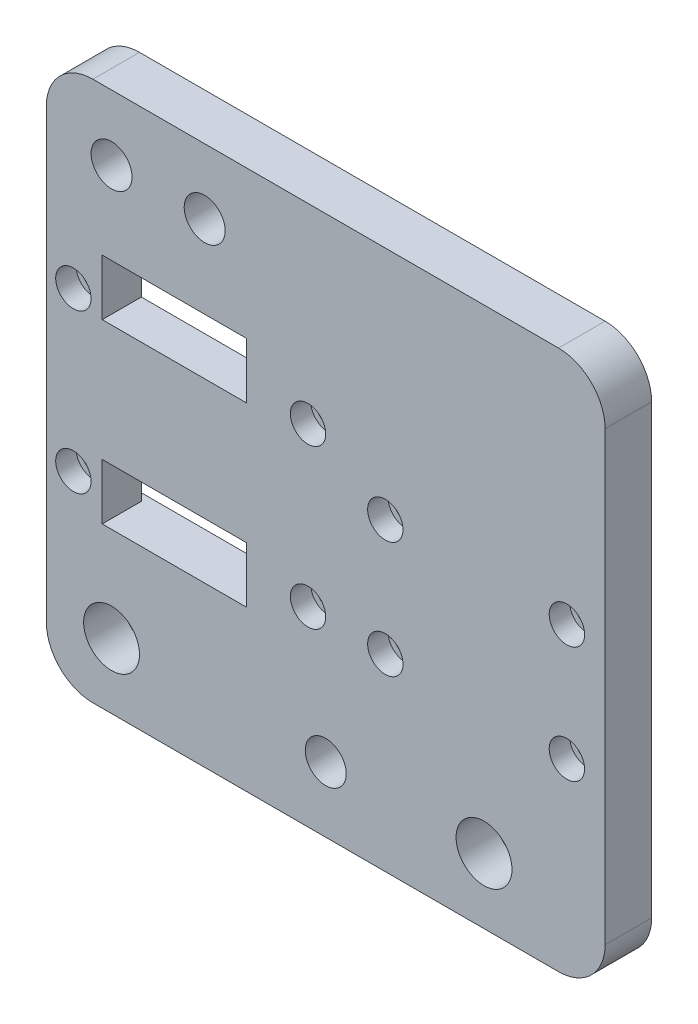
from build123d import *

# Parameters (mm, degrees)
SKETCH_1_W           = 54
SKETCH_1_H           = 58
SKETCH_1_R           = 3
EXTRUDE_1_DEPTH      = 5
SKETCH_3_R           = 6
CUT_EXTRUDE_1_DEPTH  = 0.8
CUT_EXTRUDE_2_REACH  = 81.404
SKETCH_4_R           = 1.25
SKETCH_5_W           = 31.5
SKETCH_5_H           = 25
CUT_EXTRUDE_3_DEPTH  = 0.8
CUT_EXTRUDE_4_REACH  = 81.358
SKETCH_6_W           = 15.5
SKETCH_6_H           = 6
CUT_EXTRUDE_START    = -2.2
SKETCH_7_R           = 1.9
SKETCH_7_R_2         = 1.25
CUT_EXTRUDE_5_DEPTH  = 2.2
SKETCH_8_W           = 5
SKETCH_8_H           = 58
EXTRUDE_2_DEPTH      = 6
SKETCH_9_W           = 27.5
SKETCH_9_H           = 33.5
CUT_EXTRUDE_6_DEPTH  = 0.8
SKETCH_10_R          = 1.25
CUT_EXTRUDE_7_DEPTH  = 4.2
SKETCH_11_R          = 1.9
CUT_EXTRUDE_8_DEPTH  = 2.2
FILLET_1_R           = 5
SKETCH_12_W          = 60
SKETCH_12_H          = 3
EXTRUDE_3_DEPTH      = 20
EXTRUDE_3_2_DEPTH    = 20
SKETCH_13_W          = 60
SKETCH_13_H          = 3
EXTRUDE_4_DEPTH      = 3
SKETCH_14_R          = 2.2
CUT_EXTRUDE_9_DEPTH  = 5
EXTRUDE_START        = -5
SKETCH_15_R          = 2.2
EXTRUDE_5_DEPTH      = 5
CUT_EXTRUDE_10_REACH = 81.107
SKETCH_16_W          = 27.5
SKETCH_16_H          = 10
SKETCH_17_W          = 7
SKETCH_17_H          = 27
EXTRUDE_6_DEPTH      = 3
SKETCH_18_W          = 27.5
SKETCH_18_H          = 3
SKETCH_18_W_2        = 15.5
SKETCH_18_H_2        = 6
EXTRUDE_8_DEPTH      = 3
CUT_EXTRUDE_11_DEPTH = 3
SKETCH_20_W          = 10
SKETCH_20_H          = 4.5
SKETCH_20_W_2        = 10.2
SKETCH_20_H_2        = 4.4
CUT_EXTRUDE_12_DEPTH = 3
SKETCH_21_W          = 17
SKETCH_21_H          = 4
EXTRUDE_9_DEPTH      = 20
FILLET_2_R           = 5


with BuildPart() as part:
    # 草图1 → 凸台-拉伸1 (new body)
    with BuildSketch(Plane.XY):
        with Locations((27, 29)):
            Rectangle(SKETCH_1_W, SKETCH_1_H)
        with Locations((7, 7)):
            Circle(SKETCH_1_R, mode=Mode.SUBTRACT)
        with Locations((47, 7)):
            Circle(SKETCH_1_R, mode=Mode.SUBTRACT)
    extrude(amount=EXTRUDE_1_DEPTH)

    # 草图3 → 切除-拉伸1 (cut)
    with BuildSketch(Plane(origin=(0, 0, 0), x_dir=(-1, 0, 0), z_dir=(0, 0, -1))):
        with Locations((-47, 7)):
            Circle(SKETCH_3_R)
        with Locations((-7, 7)):
            Circle(SKETCH_3_R)
    extrude(amount=-CUT_EXTRUDE_1_DEPTH, mode=Mode.SUBTRACT)

    # 草图4 → 切除-拉伸2 (cut, up to next)
    with BuildSketch(Plane(origin=(0, 0, 0), x_dir=(-1, 0, 0), z_dir=(0, 0, -1)), mode=Mode.PRIVATE) as cut_extrude_2_sk1:
        with Locations((-28.1, 37.5)):
            Circle(SKETCH_4_R)
    cut_extrude_2_tool1 = extrude(cut_extrude_2_sk1.sketch, amount=-CUT_EXTRUDE_2_REACH, mode=Mode.PRIVATE) & part.part
    # 草图4 → 切除-拉伸2 (cut, up to next)
    with BuildSketch(Plane(origin=(0, 0, 0), x_dir=(-1, 0, 0), z_dir=(0, 0, -1)), mode=Mode.PRIVATE) as cut_extrude_2_sk2:
        with Locations((-2.9, 37.5)):
            Circle(SKETCH_4_R)
    cut_extrude_2_tool2 = extrude(cut_extrude_2_sk2.sketch, amount=-CUT_EXTRUDE_2_REACH, mode=Mode.PRIVATE) & part.part
    # 草图4 → 切除-拉伸2 (cut, up to next)
    with BuildSketch(Plane(origin=(0, 0, 0), x_dir=(-1, 0, 0), z_dir=(0, 0, -1)), mode=Mode.PRIVATE) as cut_extrude_2_sk3:
        with Locations((-28.1, 20.5)):
            Circle(SKETCH_4_R)
    cut_extrude_2_tool3 = extrude(cut_extrude_2_sk3.sketch, amount=-CUT_EXTRUDE_2_REACH, mode=Mode.PRIVATE) & part.part
    # 草图4 → 切除-拉伸2 (cut, up to next)
    with BuildSketch(Plane(origin=(0, 0, 0), x_dir=(-1, 0, 0), z_dir=(0, 0, -1)), mode=Mode.PRIVATE) as cut_extrude_2_sk4:
        with Locations((-2.9, 20.5)):
            Circle(SKETCH_4_R)
    cut_extrude_2_tool4 = extrude(cut_extrude_2_sk4.sketch, amount=-CUT_EXTRUDE_2_REACH, mode=Mode.PRIVATE) & part.part
    add(cut_extrude_2_tool1.solids().sort_by_distance((28.1, 37.5, 0))[0], mode=Mode.SUBTRACT)
    add(cut_extrude_2_tool2.solids().sort_by_distance((2.9, 37.5, 0))[0], mode=Mode.SUBTRACT)
    add(cut_extrude_2_tool3.solids().sort_by_distance((28.1, 20.5, 0))[0], mode=Mode.SUBTRACT)
    add(cut_extrude_2_tool4.solids().sort_by_distance((2.9, 20.5, 0))[0], mode=Mode.SUBTRACT)

    # 草图5 → 切除-拉伸3 (cut)
    with BuildSketch(Plane(origin=(0, 0, 0), x_dir=(-1, 0, 0), z_dir=(0, 0, -1))):
        with Locations((-15.75, 29.640349145)):
            Rectangle(SKETCH_5_W, SKETCH_5_H)
    extrude(amount=-CUT_EXTRUDE_3_DEPTH, mode=Mode.SUBTRACT)

    # 草图6 → 切除-拉伸4 (cut, up to next)
    with BuildSketch(Plane(origin=(0, 0, 0.8), x_dir=(-1, 0, 0), z_dir=(0, 0, -1)), mode=Mode.PRIVATE) as cut_extrude_4_sk1:
        with Locations((-13.75, 39.140349145)):
            Rectangle(SKETCH_6_W, SKETCH_6_H)
    cut_extrude_4_tool1 = extrude(cut_extrude_4_sk1.sketch, amount=-CUT_EXTRUDE_4_REACH, mode=Mode.PRIVATE) & part.part
    # 草图6 → 切除-拉伸4 (cut, up to next)
    with BuildSketch(Plane(origin=(0, 0, 0.8), x_dir=(-1, 0, 0), z_dir=(0, 0, -1)), mode=Mode.PRIVATE) as cut_extrude_4_sk2:
        with Locations((-13.75, 20.140349145)):
            Rectangle(SKETCH_6_W, SKETCH_6_H)
    cut_extrude_4_tool2 = extrude(cut_extrude_4_sk2.sketch, amount=-CUT_EXTRUDE_4_REACH, mode=Mode.PRIVATE) & part.part
    add(cut_extrude_4_tool1.solids().sort_by_distance((13.75, 39.140349, 0.8))[0], mode=Mode.SUBTRACT)
    add(cut_extrude_4_tool2.solids().sort_by_distance((13.75, 20.140349, 0.8))[0], mode=Mode.SUBTRACT)

    # 草图7 → 切除-拉伸5 (cut)
    # profile 1 of 4: a face of its own
    with BuildSketch(Plane.XY.offset(5).offset(CUT_EXTRUDE_START)):
        with Locations((2.9, 37.5)):
            Circle(SKETCH_7_R)
        with Locations(Location((2.9, 37.5, 0), (0, 0, 180))):
            Circle(SKETCH_7_R_2, mode=Mode.SUBTRACT)
    # profile 2 of 4: a face of its own
    with BuildSketch(Plane.XY.offset(5).offset(CUT_EXTRUDE_START)):
        with Locations((28.1, 37.5)):
            Circle(SKETCH_7_R)
        with Locations(Location((28.1, 37.5, 0), (0, 0, 180))):
            Circle(SKETCH_7_R_2, mode=Mode.SUBTRACT)
    # profile 3 of 4: a face of its own
    with BuildSketch(Plane.XY.offset(5).offset(CUT_EXTRUDE_START)):
        with Locations((28.1, 20.5)):
            Circle(SKETCH_7_R)
        with Locations(Location((28.1, 20.5, 0), (0, 0, 180))):
            Circle(SKETCH_7_R_2, mode=Mode.SUBTRACT)
    # profile 4 of 4: a face of its own
    with BuildSketch(Plane.XY.offset(5).offset(CUT_EXTRUDE_START)):
        with Locations((2.9, 20.5)):
            Circle(SKETCH_7_R)
        with Locations(Location((2.9, 20.5, 0), (0, 0, 180))):
            Circle(SKETCH_7_R_2, mode=Mode.SUBTRACT)
    extrude(amount=CUT_EXTRUDE_5_DEPTH, mode=Mode.SUBTRACT)

    # 草图8 → 凸台-拉伸2 (add)
    with BuildSketch(Plane(origin=(54, 0, 0), x_dir=(0, 0, -1), z_dir=(1, 0, 0))):
        with Locations((-2.5, 29)):
            Rectangle(SKETCH_8_W, SKETCH_8_H)
    extrude(amount=EXTRUDE_2_DEPTH)

    # 草图9 → 切除-拉伸6 (cut)
    with BuildSketch(Plane(origin=(0, 0, 0), x_dir=(-1, 0, 0), z_dir=(0, 0, -1))):
        with Locations((-45.25, 33.890349145)):
            Rectangle(SKETCH_9_W, SKETCH_9_H)
    extrude(amount=-CUT_EXTRUDE_6_DEPTH, mode=Mode.SUBTRACT)

    # 草图10 → 切除-拉伸7 (cut)
    with BuildSketch(Plane(origin=(0, 0, 0.8), x_dir=(-1, 0, 0), z_dir=(0, 0, -1))):
        with Locations((-55.9, 32.740349145)):
            Circle(SKETCH_10_R)
        with Locations((-55.9, 20.240349145)):
            Circle(SKETCH_10_R)
        with Locations((-36.4, 20.240349145)):
            Circle(SKETCH_10_R)
        with Locations((-36.4, 32.740349145)):
            Circle(SKETCH_10_R)
    extrude(amount=-CUT_EXTRUDE_7_DEPTH, mode=Mode.SUBTRACT)

    # 草图11 → 切除-拉伸8 (cut)
    with BuildSketch(Plane.XY.offset(5)):
        with Locations((36.4, 20.240349145)):
            Circle(SKETCH_11_R)
        with Locations((55.9, 20.240349145)):
            Circle(SKETCH_11_R)
        with Locations((55.9, 32.740349145)):
            Circle(SKETCH_11_R)
        with Locations((36.4, 32.740349145)):
            Circle(SKETCH_11_R)
    extrude(amount=-CUT_EXTRUDE_8_DEPTH, mode=Mode.SUBTRACT)

    # 圆角1
    fillet_1_edges = [part.edges().sort_by_distance(p)[0] for p in [
        (60, 0, 2.5),
        (60, 58, 2.5),
        (0, 58, 2.5),
        (0, 0, 2.5),
    ]]
    fillet(fillet_1_edges, radius=FILLET_1_R)

    # 草图14 → 切除-拉伸9 (cut)
    with BuildSketch(Plane(origin=(0, 0, 0), x_dir=(-1, 0, 0), z_dir=(0, 0, -1))):
        with Locations((-30, 7)):
            Circle(SKETCH_14_R)
        with Locations((-17, 51)):
            Circle(SKETCH_14_R)
        with Locations((-7, 51)):
            Circle(SKETCH_14_R)
    extrude(amount=-CUT_EXTRUDE_9_DEPTH, mode=Mode.SUBTRACT)


with BuildPart() as body_2:
    # 草图12 → 凸台-拉伸3 (new body)
    with BuildSketch(Plane(origin=(0, 0, 0), x_dir=(-1, 0, 0), z_dir=(0, 0, -1))):
        with Locations((-30, 14.640349145)):
            Rectangle(SKETCH_12_W, SKETCH_12_H)
    extrude(amount=EXTRUDE_3_DEPTH)



with BuildPart() as body_3:
    # 草图12 → Extrude 3 2 (new body)
    with BuildSketch(Plane(origin=(0, 0, 0), x_dir=(-1, 0, 0), z_dir=(0, 0, -1))):
        with BuildLine():
            Line((-60, 53), (-60, 51.640349145))
            Line((-60, 51.640349145), (-30.5, 51.640349145))
            Line((-30.5, 51.640349145), (-30.5, 43.140349145))
            Line((-30.5, 43.140349145), (0, 43.140349145))
            Line((0, 43.140349145), (0, 46.140349145))
            Line((0, 46.140349145), (-27.5, 46.140349145))
            Line((-27.5, 46.140349145), (-27.5, 54.640349145))
            Line((-27.5, 54.640349145), (-59.723267374, 54.640349145))
            ThreePointArc((-59.723267374, 54.640349145), (-59.930331473, 53.831764129), (-60, 53))
        make_face()
    extrude(amount=EXTRUDE_3_2_DEPTH)


with BuildPart() as body_2_1:
    add(body_2.part)

    add(body_3.part)  # 凸台-拉伸4 merges body 3
    # 草图13 → 凸台-拉伸4 (add)
    with BuildSketch(Plane(origin=(0, 0, -20), x_dir=(-1, 0, 0), z_dir=(0, 0, -1))):
        Polygon((0, 43.140349145), (0, 16.140349145), (-60, 16.140349145), (-60, 51.640349145), (-30.5, 51.640349145), (-30.5, 43.140349145), align=None)
        with BuildLine():
            Line((0, 43.140349145), (0, 46.140349145))
            Line((0, 46.140349145), (-27.5, 46.140349145))
            Line((-27.5, 46.140349145), (-27.5, 54.640349145))
            Line((-27.5, 54.640349145), (-59.723267374, 54.640349145))
            ThreePointArc((-59.723267374, 54.640349145), (-59.930331473, 53.831764129), (-60, 53))
            Line((-60, 53), (-60, 51.640349145))
            Line((-60, 51.640349145), (-30.5, 51.640349145))
            Line((-30.5, 51.640349145), (-30.5, 43.140349145))
            Line((-30.5, 43.140349145), (0, 43.140349145))
        make_face()
        with Locations((-30, 14.640349145)):
            Rectangle(SKETCH_13_W, SKETCH_13_H)
    extrude(amount=EXTRUDE_4_DEPTH)

    # 草图15 → 凸台-拉伸5 (add)
    # profile 1 of 3: a face of its own
    with BuildSketch(Plane.XY.offset(EXTRUDE_START)):
        with BuildLine():
            ThreePointArc((34.5, 7), (30, 11.5), (25.5, 7))
            ThreePointArc((25.5, 7), (26.818019485, 3.818019485), (30, 2.5))
            ThreePointArc((30, 2.5), (33.181980515, 3.818019485), (34.5, 7))
        make_face()
        with Locations(Location((30, 7, 0), (0, 0, 180))):
            Circle(SKETCH_15_R, mode=Mode.SUBTRACT)
    # profile 2 of 3: a face of its own
    with BuildSketch(Plane.XY.offset(EXTRUDE_START)):
        with BuildLine():
            Line((25.5, 13.140349145), (25.5, 7))
            ThreePointArc((25.5, 7), (30, 11.5), (34.5, 7))
            Line((34.5, 7), (34.5, 13.140349145))
            Line((34.5, 13.140349145), (25.5, 13.140349145))
        make_face()
    # profile 3 of 3: a face of its own
    with BuildSketch(Plane.XY.offset(EXTRUDE_START)):
        with BuildLine():
            Line((17, 55.140349145), (7, 55.140349145))
            ThreePointArc((7, 55.140349145), (3.818019485, 53.82232966), (2.5, 50.640349145))
            Line((2.5, 50.640349145), (2.5, 46.140349145))
            Line((2.5, 46.140349145), (21.5, 46.140349145))
            Line((21.5, 46.140349145), (21.5, 50.640349145))
            ThreePointArc((21.5, 50.640349145), (20.181980515, 53.82232966), (17, 55.140349145))
        make_face()
        with Locations(Location((7, 51, 0), (0, 0, 180))):
            Circle(SKETCH_15_R, mode=Mode.SUBTRACT)
        with Locations(Location((17, 51, 0), (0, 0, 180))):
            Circle(SKETCH_15_R, mode=Mode.SUBTRACT)
    extrude(amount=EXTRUDE_5_DEPTH)

    # 切除-拉伸10: up to this face of the body (flat: up to its plane)
    cut_extrude_10_end = Plane(body_2_1.part.faces().sort_by_distance((30, 13.140349145, -11.803370787))[0])
    # 草图16 → 切除-拉伸10 (cut, up to the picked face)
    with BuildSketch(Plane(origin=(0, 46.140349145, 0), x_dir=(1, 0, 0), z_dir=(0, 1, 0)), mode=Mode.PRIVATE) as cut_extrude_10_sk1:
        with Locations((13.75, 18)):
            Rectangle(SKETCH_16_W, SKETCH_16_H)
    cut_extrude_10_tool1 = split(extrude(cut_extrude_10_sk1.sketch, amount=-CUT_EXTRUDE_10_REACH, mode=Mode.PRIVATE), bisect_by=cut_extrude_10_end, keep=Keep.BOTH, mode=Mode.PRIVATE)
    add(cut_extrude_10_tool1.solids().sort_by(Axis((13.75, 46.140349, -18), (0, -1, 0)))[0], mode=Mode.SUBTRACT)

    # 草图17 → 凸台-拉伸6 (add)
    with BuildSketch(Plane.ZY.offset(-27.5)):
        with Locations((-16.5, 29.640349145)):
            Rectangle(SKETCH_17_W, SKETCH_17_H)
    extrude(amount=-EXTRUDE_6_DEPTH)

    # 草图18 → 凸台-拉伸8 (add)
    # profile 1 of 2: a face of its own
    with BuildSketch(Plane(origin=(0, 0, -13), x_dir=(-1, 0, 0), z_dir=(0, 0, -1))):
        with Locations((-13.75, 14.640349145)):
            Rectangle(SKETCH_18_W, SKETCH_18_H)
    # profile 2 of 2: a face of its own
    with BuildSketch(Plane(origin=(0, 0, -13), x_dir=(-1, 0, 0), z_dir=(0, 0, -1))):
        Polygon((0, 16.140349145), (0, 17.140349145), (0, 42.140349145), (0, 43.140349145), (0, 46.140349145), (-27.5, 46.140349145), (-27.5, 43.140349145), (-27.5, 16.140349145), align=None)
        with Locations((-13.75, 20.140349145)):
            Rectangle(SKETCH_18_W_2, SKETCH_18_H_2, mode=Mode.SUBTRACT)
        with Locations((-13.75, 39.140349145)):
            Rectangle(SKETCH_18_W_2, SKETCH_18_H_2, mode=Mode.SUBTRACT)
    extrude(amount=EXTRUDE_8_DEPTH)

    # 草图19 → 切除-拉伸11 (cut)
    # profile 1 of 3: a face of its own
    with BuildSketch(Plane(origin=(0, 54.640349145, 0), x_dir=(1, 0, 0), z_dir=(0, 1, 0))):
        Polygon((34, 4.2), (43, 4.2), (43, 11.7), (43, 16.7), (34, 16.7), (34, 11.7), align=None)
    # profile 2 of 3: a face of its own
    with BuildSketch(Plane(origin=(0, 54.640349145, 0), x_dir=(1, 0, 0), z_dir=(0, 1, 0))):
        with BuildLine():
            Line((49.05, 1.7), (54.85, 1.7))
            ThreePointArc((54.85, 1.7), (58.9, 5.75), (54.85, 9.8))
            Line((54.85, 9.8), (49.05, 9.8))
            ThreePointArc((49.05, 9.8), (45, 5.75), (49.05, 1.7))
        make_face()
        with BuildLine():
            ThreePointArc((49.05, 7.3), (47.5, 5.75), (49.05, 4.2))
            Line((49.05, 4.2), (54.85, 4.2))
            ThreePointArc((54.85, 4.2), (56.4, 5.75), (54.85, 7.3))
            Line((54.85, 7.3), (49.05, 7.3))
        make_face(mode=Mode.SUBTRACT)
    # profile 3 of 3: a face of its own
    with BuildSketch(Plane(origin=(0, 54.640349145, 0), x_dir=(1, 0, 0), z_dir=(0, 1, 0))):
        with BuildLine():
            Line((54.85, 7.3), (49.05, 7.3))
            ThreePointArc((49.05, 7.3), (47.5, 5.75), (49.05, 4.2))
            Line((49.05, 4.2), (54.85, 4.2))
            ThreePointArc((54.85, 4.2), (56.4, 5.75), (54.85, 7.3))
        make_face()
    extrude(amount=-CUT_EXTRUDE_11_DEPTH, mode=Mode.SUBTRACT)

    # 草图20 → 切除-拉伸12 (cut)
    with BuildSketch(Plane(origin=(0, 0, -23), x_dir=(-1, 0, 0), z_dir=(0, 0, -1))):
        with Locations((-45.5, 19.390349145)):
            Rectangle(SKETCH_20_W, SKETCH_20_H)
        Polygon((-50.5, 26.140349145), (-50.5, 22.640349145), (-40.5, 22.640349145), (-40.5, 27.140349145), (-49.5, 27.140349145), align=None)
        with Locations((-54.9, 40.340349145)):
            Rectangle(SKETCH_20_W_2, SKETCH_20_H_2)
    extrude(amount=-CUT_EXTRUDE_12_DEPTH, mode=Mode.SUBTRACT)

    # 草图21 → 凸台-拉伸9 (add)
    with BuildSketch(Plane.ZY):
        with Locations((-3.5, -2.859650855)):
            Rectangle(SKETCH_21_W, SKETCH_21_H)
        Polygon((-12, 13.140349145), (-16, 13.140349145), (-16, -4.859650855), (-12, -4.859650855), (-12, -0.859650855), align=None)
    extrude(amount=-EXTRUDE_9_DEPTH)

    # 圆角2
    fillet_2_edges = [body_2_1.edges().sort_by_distance(p)[0] for p in [
        (10, -4.859650855, -16),
    ]]
    fillet(fillet_2_edges, radius=FILLET_2_R)


solid = part.part
